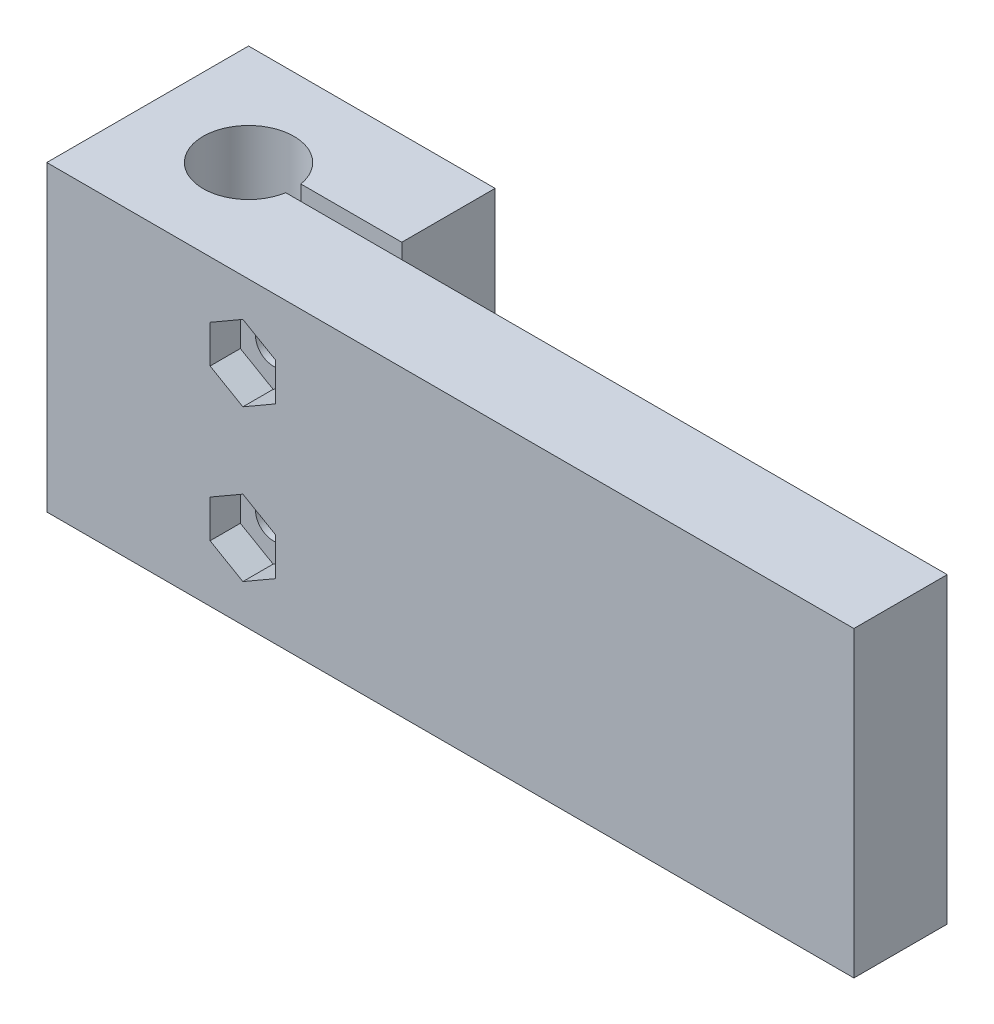
from build123d import *

# Parameters (mm, degrees)
MAIN_BODY_DEPTH      = 15
HOLES_DEPTH          = 84.815273071
HEX_NUT_RECESS_DEPTH = 3


with BuildPart() as part:
    # Schizzo2 → Main Body (new, symmetric)
    with BuildSketch(Plane(origin=(0, 0, 0), x_dir=(1, 0, 0), z_dir=(0, 1, 0))):
        with BuildLine():
            Line((0, 0), (0, 20))
            Line((0, 20), (24.437059837, 20))
            Line((24.437059837, 20), (24.437059837, 10.75))
            Line((24.437059837, 10.75), (14.437059837, 10.75))
            ThreePointArc((14.437059837, 10.75), (5.5, 10), (14.437059837, 9.25))
            Line((14.437059837, 9.25), (80, 9.25))
            Line((80, 9.25), (80, 0))
            Line((80, 0), (0, 0))
        make_face()
    extrude(amount=MAIN_BODY_DEPTH, both=True)

    # Schizzo3 → Holes (cut, through all)
    with BuildSketch(Plane(origin=(0, 0, -20), x_dir=(-1, 0, 0), z_dir=(0, 0, -1))):
        with BuildLine():
            Line((-20.447422808, -5.75), (-18.426696866, -5.75))
            Line((-18.426696866, -5.75), (-17.921515381, -6.625))
            ThreePointArc((-17.921515381, -6.625), (-19.437059837, -9.25), (-20.952604294, -6.625))
            Line((-20.952604294, -6.625), (-20.447422808, -5.75))
        make_face()
        with BuildLine():
            Line((-20.447422808, 9.25), (-18.426696866, 9.25))
            Line((-18.426696866, 9.25), (-17.921515381, 8.375))
            ThreePointArc((-17.921515381, 8.375), (-19.437059837, 5.75), (-20.952604294, 8.375))
            Line((-20.952604294, 8.375), (-20.447422808, 9.25))
        make_face()
    extrude(amount=-HOLES_DEPTH, mode=Mode.SUBTRACT)

    # Schizzo4 → Hex nut recess (cut)
    with BuildSketch(Plane.XY):
        Polygon((19.437059837, 11.25277675), (16.187059837, 9.376388375), (16.187059837, 5.623611625), (19.437059837, 3.74722325), (22.687059837, 5.623611625), (22.687059837, 9.376388375), align=None)
        Polygon((19.437059837, -3.74722325), (16.187059837, -5.623611625), (16.187059837, -9.376388375), (19.437059837, -11.25277675), (22.687059837, -9.376388375), (22.687059837, -5.623611625), align=None)
    extrude(amount=-HEX_NUT_RECESS_DEPTH, mode=Mode.SUBTRACT)


solid = part.part
